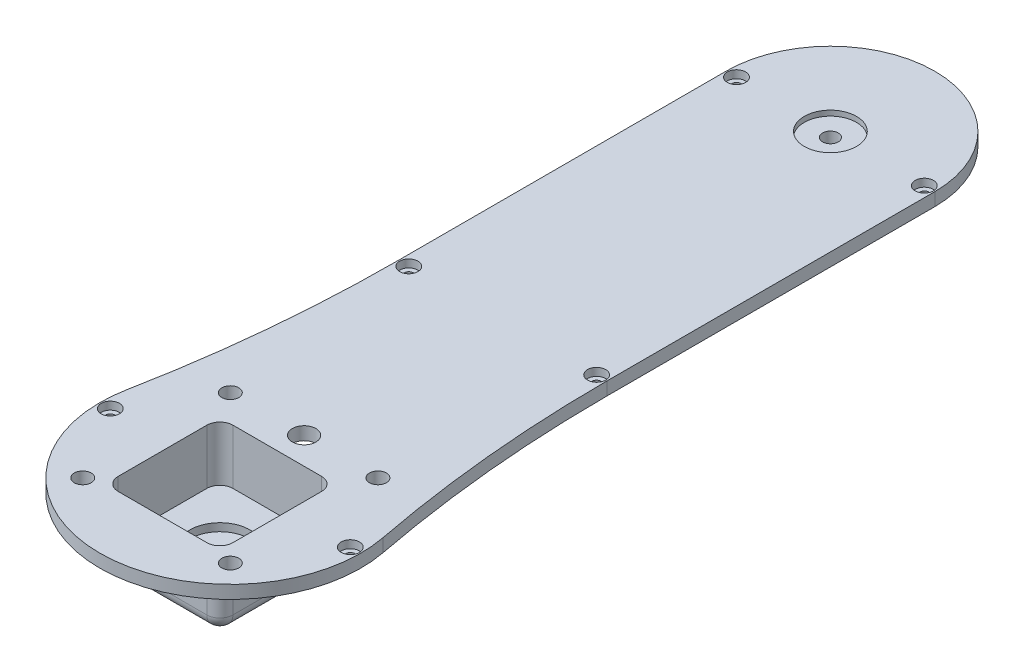
from build123d import *

# Parameters (mm, degrees)
EXTRUDE_1_DEPTH      = 5
SKETCH_2_R           = 3.25
CUT_EXTRUDE_1_DEPTH  = 5
SKETCH_10_R          = 1.75
CUT_EXTRUDE_8_DEPTH  = 45
SKETCH_11_R          = 3.5
CUT_EXTRUDE_9_DEPTH  = 3
SKETCH_12_W          = 44
SKETCH_12_H          = 44
CUT_EXTRUDE_10_DEPTH = 5
SKETCH_13_W          = 44
SKETCH_13_H          = 44
EXTRUDE_2_DEPTH      = 16
EXTRUDE_3_DEPTH      = 4
FILLET_1_R           = 5
SKETCH_16_R          = 11.5
CUT_EXTRUDE_11_DEPTH = 3
SKETCH_17_R          = 3
CUT_EXTRUDE_12_DEPTH = 3
FILLET_2_R           = 5
SKETCH_20_R          = 3
CUT_EXTRUDE_14_DEPTH = 39
EXTRUDE_START        = 20
SKETCH_21_R          = 4.5
SKETCH_21_R_2        = 3
EXTRUDE_4_DEPTH      = 20
CHAMFER_1_SIZE       = 10
CHAMFER_1_SIZE2      = 17.320508076
SKETCH_22_R          = 10
CUT_EXTRUDE_15_DEPTH = 2
SKETCH_23_R          = 4.5
CUT_EXTRUDE_16_DEPTH = 5


with BuildPart() as part:
    # 草图1 → 凸台-拉伸1 (new body)
    with BuildSketch(Plane(origin=(0, 0, 0), x_dir=(1, 0, 0), z_dir=(0, 1, 0))):
        with BuildLine():
            Line((-40, 104.403065089), (-40, 230))
            ThreePointArc((-40, 230), (0, 270), (40, 230))
            Line((40, 230), (40, 104.403065089))
            ThreePointArc((40, 104.403065089), (42.277916175, 56.729935627), (49.090909091, 9.491187735))
            ThreePointArc((49.090909091, 9.491187735), (0, -50), (-49.090909091, 9.491187735))
            ThreePointArc((-49.090909091, 9.491187735), (-42.277916175, 56.729935627), (-40, 104.403065089))
        make_face()
    extrude(amount=EXTRUDE_1_DEPTH)

    # 草图2 → 切除-拉伸1 (cut)
    with BuildSketch(Plane(origin=(0, 5, 0), x_dir=(1, 0, 0), z_dir=(0, 1, 0))):
        with Locations(Location((28.284271247, 28.284271247, 0), (0, 0, 270))):
            Circle(SKETCH_2_R)
        with Locations(Location((28.284271247, -28.284271247, 0), (0, 0, 270))):
            Circle(SKETCH_2_R)
        with Locations(Location((-28.284271247, -28.284271247, 0), (0, 0, 270))):
            Circle(SKETCH_2_R)
        with Locations(Location((-28.284271247, 28.284271247, 0), (0, 0, 270))):
            Circle(SKETCH_2_R)
    extrude(amount=-CUT_EXTRUDE_1_DEPTH, mode=Mode.SUBTRACT)

    # 草图10 → 切除-拉伸8 (cut)
    with BuildSketch(Plane.XZ):
        with Locations(Location((46, 0, 0), (0, 0, 270))):
            Circle(SKETCH_10_R)
        with Locations(Location((36, -104.403065089, 0), (0, 0, 270))):
            Circle(SKETCH_10_R)
        with Locations(Location((36, -230, 0), (0, 0, 270))):
            Circle(SKETCH_10_R)
        with Locations(Location((-36, -230, 0), (0, 0, 270))):
            Circle(SKETCH_10_R)
        with Locations(Location((-36, -104.403065089, 0), (0, 0, 270))):
            Circle(SKETCH_10_R)
        with Locations(Location((-46, 0, 0), (0, 0, 270))):
            Circle(SKETCH_10_R)
    extrude(amount=-CUT_EXTRUDE_8_DEPTH, mode=Mode.SUBTRACT)

    # 草图11 → 切除-拉伸9 (cut)
    with BuildSketch(Plane(origin=(0, 5, 0), x_dir=(1, 0, 0), z_dir=(0, 1, 0))):
        with Locations(Location((-36, 230, 0), (0, 0, 270))):
            Circle(SKETCH_11_R)
        with Locations(Location((-36, 104.403065089, 0), (0, 0, 270))):
            Circle(SKETCH_11_R)
        with Locations(Location((-46, 0, 0), (0, 0, 270))):
            Circle(SKETCH_11_R)
        with Locations(Location((46, 0, 0), (0, 0, 90))):
            Circle(SKETCH_11_R)
        with Locations(Location((36, 104.403065089, 0), (0, 0, 90))):
            Circle(SKETCH_11_R)
        with Locations(Location((36, 230, 0), (0, 0, 90))):
            Circle(SKETCH_11_R)
    extrude(amount=-CUT_EXTRUDE_9_DEPTH, mode=Mode.SUBTRACT)

    # 草图12 → 切除-拉伸10 (cut)
    with BuildSketch(Plane(origin=(0, 5, 0), x_dir=(1, 0, 0), z_dir=(0, 1, 0))):
        with Locations((0, -4)):
            Rectangle(SKETCH_12_W, SKETCH_12_H)
    extrude(amount=-CUT_EXTRUDE_10_DEPTH, mode=Mode.SUBTRACT)

    # 草图13 → 凸台-拉伸2 (add)
    with BuildSketch(Plane.XZ):
        with BuildLine():
            Line((-21, 30), (21, 30))
            ThreePointArc((21, 30), (24.535533906, 28.535533906), (26, 25))
            Line((26, 25), (26, -17))
            ThreePointArc((26, -17), (24.535533906, -20.535533906), (21, -22))
            Line((21, -22), (-21, -22))
            ThreePointArc((-21, -22), (-24.535533906, -20.535533906), (-26, -17))
            Line((-26, -17), (-26, 25))
            ThreePointArc((-26, 25), (-24.535533906, 28.535533906), (-21, 30))
        make_face()
        with Locations((0, 4)):
            Rectangle(SKETCH_13_W, SKETCH_13_H, mode=Mode.SUBTRACT)
    extrude(amount=EXTRUDE_2_DEPTH)

    # 草图15 → 凸台-拉伸3 (add)
    with BuildSketch(Plane.XZ.offset(16)):
        with BuildLine():
            Line((26, -17), (26, 25))
            ThreePointArc((26, 25), (24.535533906, 28.535533906), (21, 30))
            Line((21, 30), (-21, 30))
            ThreePointArc((-21, 30), (-24.535533906, 28.535533906), (-26, 25))
            Line((-26, 25), (-26, -17))
            ThreePointArc((-26, -17), (-24.535533906, -20.535533906), (-21, -22))
            Line((-21, -22), (21, -22))
            ThreePointArc((21, -22), (24.535533906, -20.535533906), (26, -17))
        make_face()
    extrude(amount=EXTRUDE_3_DEPTH)

    # 圆角1
    fillet_1_edges = [part.edges().sort_by_distance(p)[0] for p in [
        (24.535533906, -20, 28.535533906),
        (0, -20, 30),
        (-24.535533906, -20, 28.535533906),
        (-26, -20, 4),
        (-24.535533906, -20, -20.535533906),
        (0, -20, -22),
        (24.535533906, -20, -20.535533906),
        (26, -20, 4),
    ]]
    fillet(fillet_1_edges, radius=FILLET_1_R)

    # 草图16 → 切除-拉伸11 (cut)
    with BuildSketch(Plane(origin=(0, -16, 0), x_dir=(1, 0, 0), z_dir=(0, 1, 0))):
        with Locations(Location((0, -4, 0), (0, 0, 270))):
            Circle(SKETCH_16_R)
    extrude(amount=-CUT_EXTRUDE_11_DEPTH, mode=Mode.SUBTRACT)

    # 草图17 → 切除-拉伸12 (cut)
    with BuildSketch(Plane(origin=(0, -19, 0), x_dir=(1, 0, 0), z_dir=(0, 1, 0))):
        with Locations(Location((0, -4, 0), (0, 0, 270))):
            Circle(SKETCH_17_R)
    extrude(amount=-CUT_EXTRUDE_12_DEPTH, mode=Mode.SUBTRACT)

    # 圆角2
    fillet_2_edges = [part.edges().sort_by_distance(p)[0] for p in [
        (22, -5.5, -18),
        (22, -5.5, 26),
        (-22, -5.5, 26),
        (-22, -5.5, -18),
    ]]
    fillet(fillet_2_edges, radius=FILLET_2_R)

    # 草图20 → 切除-拉伸14 (cut)
    with BuildSketch(Plane.XZ):
        with Locations(Location((0, -230, 0), (0, 0, 270))):
            Circle(SKETCH_20_R)
    extrude(amount=-CUT_EXTRUDE_14_DEPTH, mode=Mode.SUBTRACT)

    # 草图21 → 凸台-拉伸4 (add)
    with BuildSketch(Plane.XZ.offset(EXTRUDE_START)):
        with Locations(Location((0, -230, 0), (0, 0, 270))):
            Circle(SKETCH_21_R)
        with Locations(Location((0, -230, 0), (0, 0, 270))):
            Circle(SKETCH_21_R_2, mode=Mode.SUBTRACT)
    extrude(amount=-EXTRUDE_4_DEPTH)

    # 倒角1
    chamfer_1_edges = [part.edges().sort_by_distance(p)[0] for p in [
        (0, 0, -225.5),
    ]]
    chamfer_1_side = [part.faces().sort_by_distance(p)[0] for p in [
        (0, 0, -117.507600063),
    ]]
    chamfer(chamfer_1_edges, length=CHAMFER_1_SIZE, length2=CHAMFER_1_SIZE2, reference=chamfer_1_side[0])

    # 草图22 → 切除-拉伸15 (cut)
    with BuildSketch(Plane(origin=(0, 5, 0), x_dir=(1, 0, 0), z_dir=(0, 1, 0))):
        with Locations(Location((0, 230, 0), (0, 0, 270))):
            Circle(SKETCH_22_R)
    extrude(amount=-CUT_EXTRUDE_15_DEPTH, mode=Mode.SUBTRACT)

    # 草图23 → 切除-拉伸16 (cut)
    with BuildSketch(Plane(origin=(0, 5, 0), x_dir=(1, 0, 0), z_dir=(0, 1, 0))):
        with Locations(Location((0, 28.284271247, 0), (0, 0, 270))):
            Circle(SKETCH_23_R)
    extrude(amount=-CUT_EXTRUDE_16_DEPTH, mode=Mode.SUBTRACT)


solid = part.part
